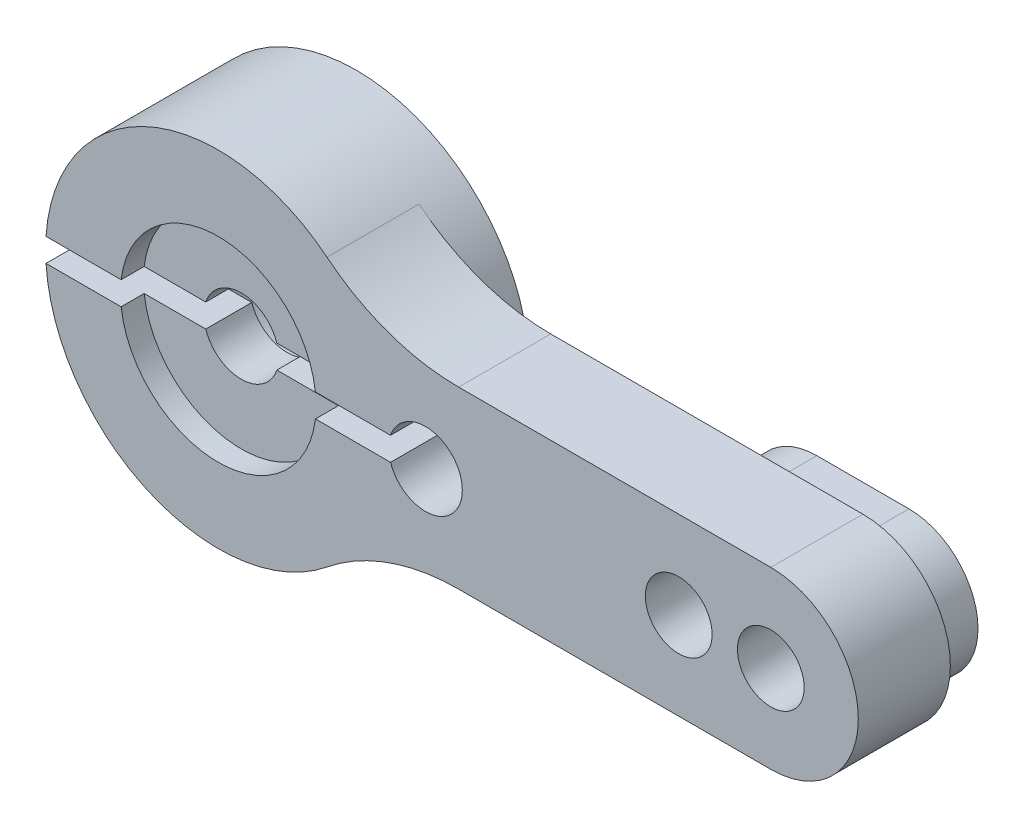
from build123d import *

# Parameters (mm, degrees)
SKETCH1_R           = 1.45
BOSS_EXTRUDE1_DEPTH = 4
BOSS_EXTRUDE3_START = 2
BOSS_EXTRUDE3_DEPTH = 2
SKETCH4_R           = 4.25
CUT_EXTRUDE1_DEPTH  = 1
SKETCH6_R           = 2.9
CUT_EXTRUDE2_DEPTH  = 1


with BuildPart() as part:
    # Sketch1 → Boss-Extrude1 (new body)
    with BuildSketch(Plane(origin=(0, 0, 0), x_dir=(0, 1, 0), z_dir=(0, 0, 1))):
        with BuildLine():
            ThreePointArc((-5.826821987, -4.722091224), (-4.321683338, -7.407935145), (-3.8, -10.442246667))
            Line((-3.8, -10.442246667), (-3.8, -24))
            ThreePointArc((-3.8, -24), (0, -27.8), (3.8, -24))
            Line((3.8, -24), (3.8, -10.442246667))
            ThreePointArc((3.8, -10.442246667), (4.321683338, -7.407935145), (5.826821987, -4.722091224))
            ThreePointArc((5.826821987, -4.722091224), (6.875471927, 2.99631203), (0.507973157, 7.482777778))
            Line((0.507973157, 7.482777778), (0.507973157, 1.543563498))
            ThreePointArc((0.507973157, 1.543563498), (1.625, 0), (0.507973157, -1.543563498))
            Line((0.507973157, -1.543563498), (0.507973157, -7.482777778))
            ThreePointArc((0.507973157, -7.482777778), (0, -10.6), (-0.507973157, -7.482777778))
            Line((-0.507973157, -7.482777778), (-0.507973157, -1.543563498))
            ThreePointArc((-0.507973157, -1.543563498), (-1.625, 0), (-0.507973157, 1.543563498))
            Line((-0.507973157, 1.543563498), (-0.507973157, 7.482777778))
            ThreePointArc((-0.507973157, 7.482777778), (-6.875471927, 2.99631203), (-5.826821987, -4.722091224))
        make_face()
        with Locations(Location((0, -24, 0), (0, 0, 270))):
            Circle(SKETCH1_R, mode=Mode.SUBTRACT)
        with Locations(Location((0, -20, 0), (0, 0, 270))):
            Circle(SKETCH1_R, mode=Mode.SUBTRACT)
    extrude(amount=BOSS_EXTRUDE1_DEPTH)

    # Sketch3 → Boss-Extrude3 (add)
    with BuildSketch(Plane(origin=(0, 0, 0), x_dir=(1, 0, 0), z_dir=(0, 0, -1)).offset(BOSS_EXTRUDE3_START)):
        with BuildLine():
            Line((20, 3), (24, 3))
            ThreePointArc((24, 3), (27, 0), (24, -3))
            Line((24, -3), (20, -3))
            ThreePointArc((20, -3), (17, 0), (20, 3))
        make_face()
        with BuildLine():
            Line((-7.482777778, 0.507973157), (-2.855164316, 0.507973157))
            ThreePointArc((-2.855164316, 0.507973157), (0, 2.9), (2.855164316, 0.507973157))
            Line((2.855164316, 0.507973157), (7.482777778, 0.507973157))
            ThreePointArc((7.482777778, 0.507973157), (0, 7.5), (-7.482777778, 0.507973157))
        make_face()
        with BuildLine():
            Line((-2.855164316, -0.507973157), (-7.482777778, -0.507973157))
            ThreePointArc((-7.482777778, -0.507973157), (0, -7.5), (7.482777778, -0.507973157))
            Line((7.482777778, -0.507973157), (2.855164316, -0.507973157))
            ThreePointArc((2.855164316, -0.507973157), (0, -2.9), (-2.855164316, -0.507973157))
        make_face()
    extrude(amount=-BOSS_EXTRUDE3_DEPTH)

    # Sketch4 → Cut-Extrude1 (cut)
    with BuildSketch(Plane.XY.offset(4)):
        Circle(SKETCH4_R)
    extrude(amount=-CUT_EXTRUDE1_DEPTH, mode=Mode.SUBTRACT)

    # Sketch6 → Cut-Extrude2 (cut)
    with BuildSketch(Plane(origin=(0, 0, 0), x_dir=(1, 0, 0), z_dir=(0, 0, -1))):
        Circle(SKETCH6_R)
    extrude(amount=-CUT_EXTRUDE2_DEPTH, mode=Mode.SUBTRACT)


solid = part.part
